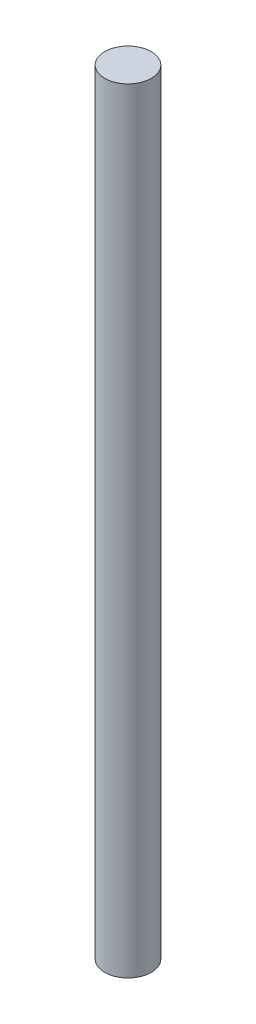
from build123d import *

# Parameters (mm, degrees)
SKETCH1_R           = 6
BOSS_EXTRUDE1_DEPTH = 200


with BuildPart() as part:
    # Sketch1 → Boss-Extrude1 (new body)
    with BuildSketch(Plane(origin=(0, 0, 0), x_dir=(1, 0, 0), z_dir=(0, 1, 0))):
        with Locations(Location((0, 0, 0), (0, 0, 270))):
            Circle(SKETCH1_R)
    extrude(amount=BOSS_EXTRUDE1_DEPTH)


solid = part.part
